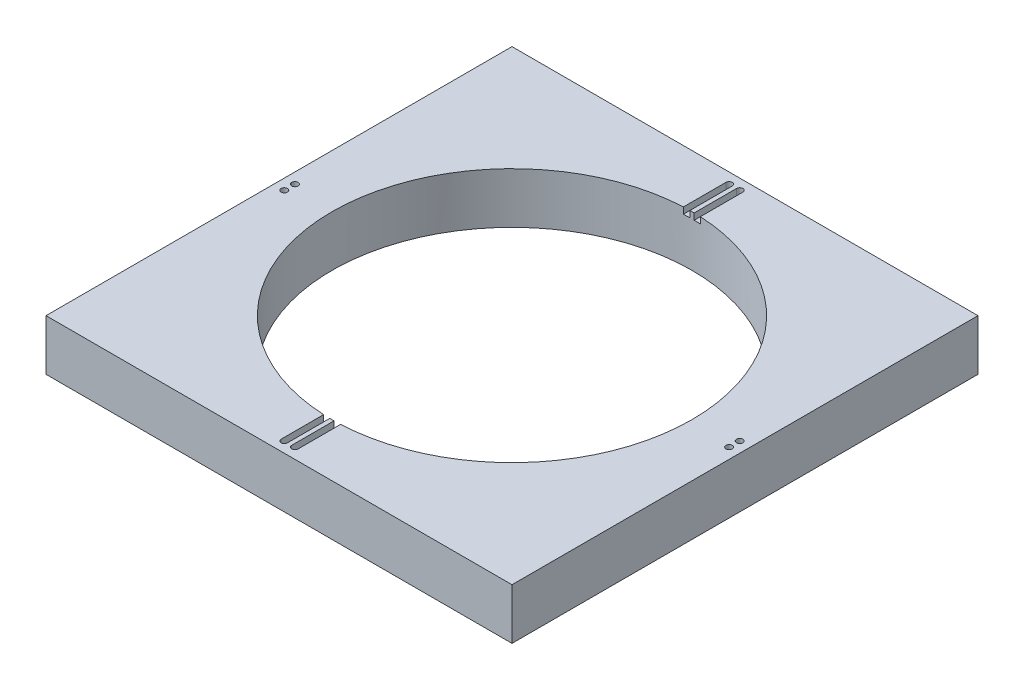
from build123d import *

# Parameters (mm, degrees)
SKETCH1_W           = 220
SKETCH1_H           = 220
SKETCH1_R           = 85
SKETCH1_R_2         = 1.5
BOSS_EXTRUDE1_DEPTH = 24
CUT_EXTRUDE1_START  = -3
CUT_EXTRUDE1_DEPTH  = 3


with BuildPart() as part:
    # Sketch1 → Boss-Extrude1 (new body)
    with BuildSketch(Plane(origin=(0, 0, 0), x_dir=(1, 0, 0), z_dir=(0, 1, 0))):
        Rectangle(SKETCH1_W, SKETCH1_H)
        with Locations(Location((0, 0, 0), (0, 0, 270))):
            Circle(SKETCH1_R, mode=Mode.SUBTRACT)
        with Locations(Location((-105, 2.5, 0), (0, 0, 270))):
            Circle(SKETCH1_R_2, mode=Mode.SUBTRACT)
        with Locations(Location((-105, -2.5, 0), (0, 0, 270))):
            Circle(SKETCH1_R_2, mode=Mode.SUBTRACT)
        with Locations(Location((105, 2.5, 0), (0, 0, 270))):
            Circle(SKETCH1_R_2, mode=Mode.SUBTRACT)
        with Locations(Location((105, -2.5, 0), (0, 0, 270))):
            Circle(SKETCH1_R_2, mode=Mode.SUBTRACT)
        with Locations(Location((-2.5, -105, 0), (0, 0, 270))):
            Circle(SKETCH1_R_2, mode=Mode.SUBTRACT)
        with Locations(Location((2.5, -105, 0), (0, 0, 270))):
            Circle(SKETCH1_R_2, mode=Mode.SUBTRACT)
        with Locations(Location((-2.5, 105, 0), (0, 0, 270))):
            Circle(SKETCH1_R_2, mode=Mode.SUBTRACT)
        with Locations(Location((2.5, 105, 0), (0, 0, 270))):
            Circle(SKETCH1_R_2, mode=Mode.SUBTRACT)
    extrude(amount=BOSS_EXTRUDE1_DEPTH)

    # Sketch2 → Cut-Extrude1 (cut)
    with BuildSketch(Plane(origin=(0, 24, 0), x_dir=(1, 0, 0), z_dir=(0, 1, 0)).offset(CUT_EXTRUDE1_START)):
        with BuildLine():
            Line((4, 105), (4, -105))
            ThreePointArc((4, -105), (2.5, -106.5), (1, -105))
            Line((1, -105), (1, 105))
            ThreePointArc((1, 105), (2.5, 106.5), (4, 105))
        make_face()
        with BuildLine():
            Line((-1, 105), (-1, -105))
            ThreePointArc((-1, -105), (-2.5, -106.5), (-4, -105))
            Line((-4, -105), (-4, 105))
            ThreePointArc((-4, 105), (-2.5, 106.5), (-1, 105))
        make_face()
    extrude(amount=CUT_EXTRUDE1_DEPTH, mode=Mode.SUBTRACT)


solid = part.part
